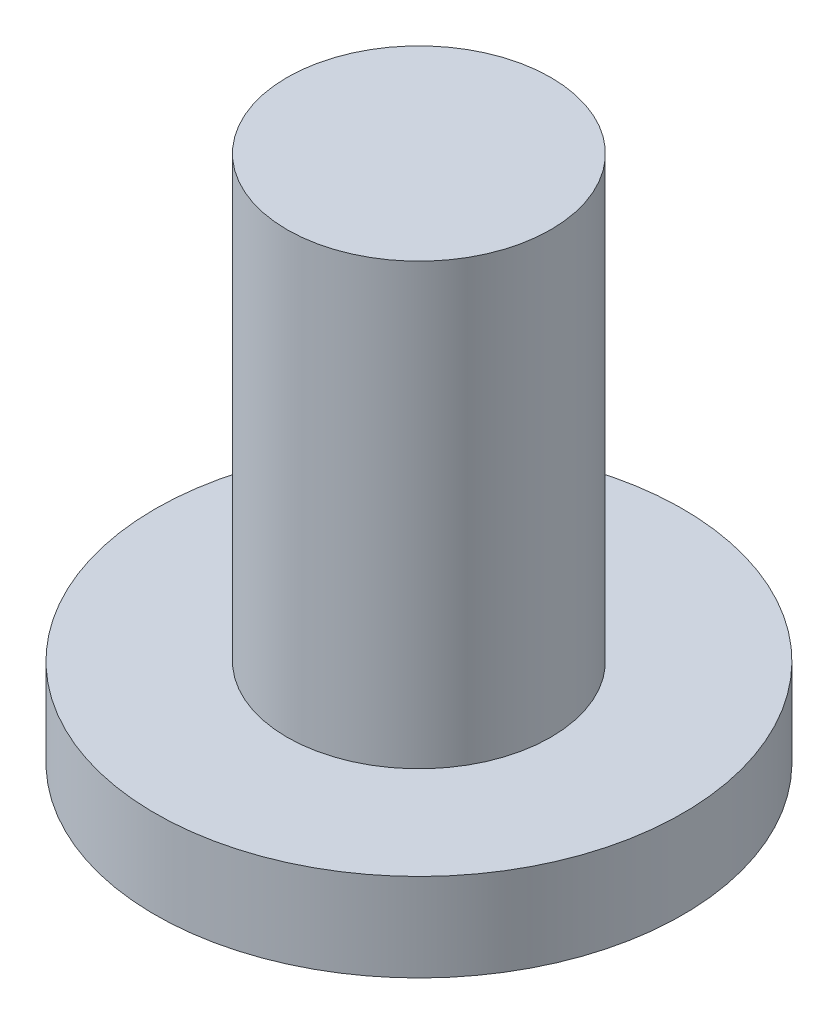
from build123d import *


with BuildPart() as part:
    # Sketch1 → Revolve1 (revolve)
    with BuildSketch(Plane.XY):
        Polygon((0, 0), (-6, 0), (-6, 2), (-3, 2), (-3, 12), (0, 12), align=None)
    revolve(axis=Axis((0, 12, 0), (0, -1, 0)))


solid = part.part
